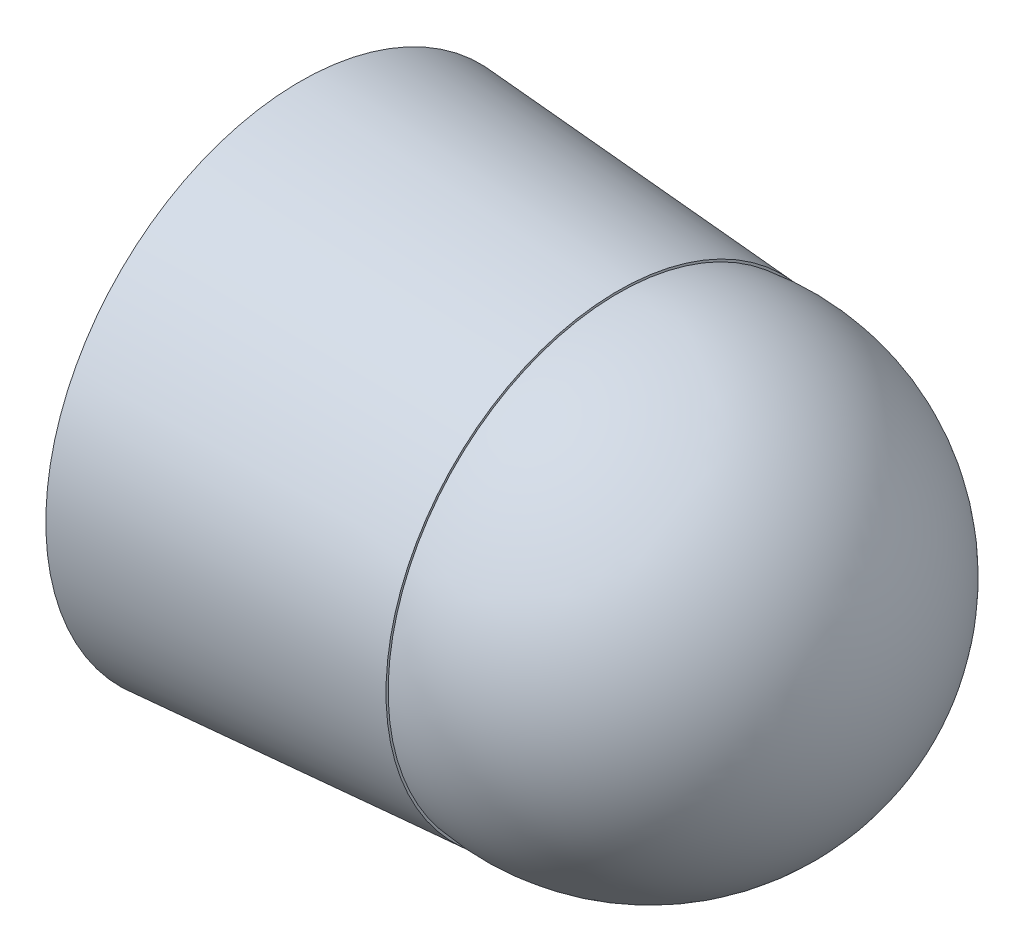
from build123d import *

# Parameters (mm, degrees)
SKETCH1_R           = 8
BOSS_EXTRUDE1_DEPTH = 10
BOSS_EXTRUDE1_TAPER = 4


with BuildPart() as part:
    # Sketch1 → Boss-Extrude1 (new body)
    with BuildSketch(Plane(origin=(0, 0, 0), x_dir=(0, 0, -1), z_dir=(1, 0, 0))):
        Circle(SKETCH1_R)
    extrude(amount=BOSS_EXTRUDE1_DEPTH, taper=BOSS_EXTRUDE1_TAPER)

    # Sketch2 → Revolve1 (revolve)
    with BuildSketch(Plane(origin=(11, 0, 0), x_dir=(0, 0, -1), z_dir=(1, 0, 0))):
        with BuildLine():
            Line((0, 7.300731881), (0, -7.300731881))
            ThreePointArc((0, -7.300731881), (7.300731881, 0), (0, 7.300731881))
        make_face()
    revolve(axis=Axis((11, 7.300731881, 0), (0, -1, 0)))


solid = part.part
